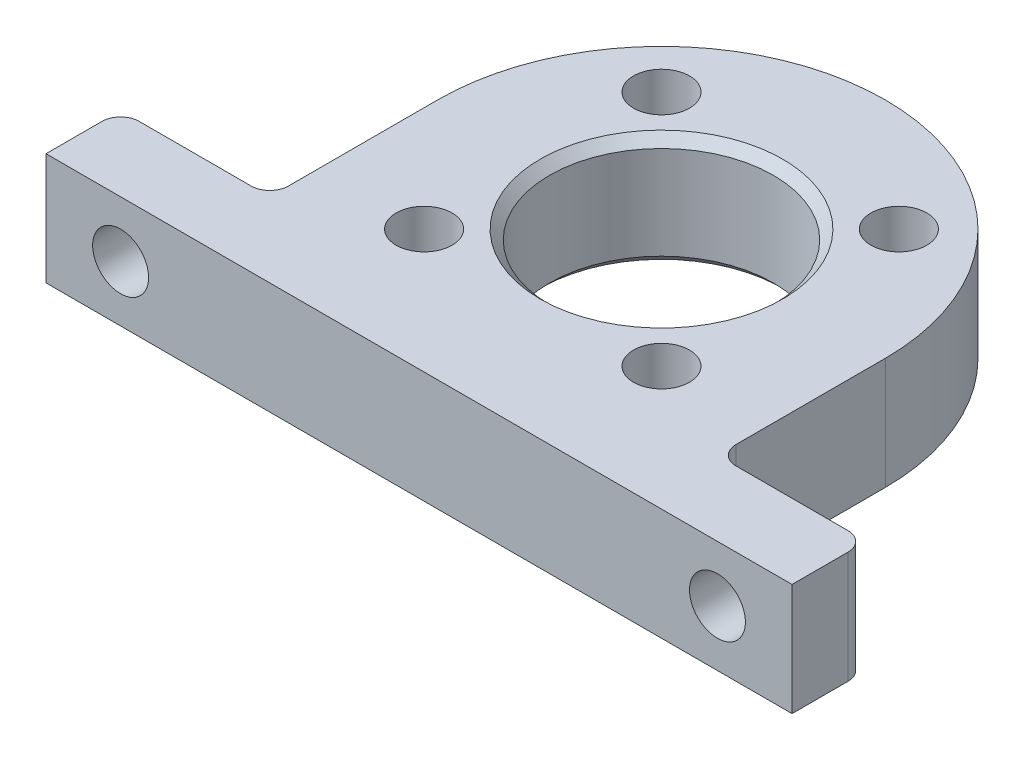
from build123d import *

# Parameters (mm, degrees)
EXTRUDE_1_DEPTH     = 6
SKETCH_2_R          = 6
CUT_EXTRUDE_1_DEPTH = 6
SKETCH_3_R          = 1.5
CUT_EXTRUDE_2_DEPTH = 6
SKETCH_9_W          = 40
SKETCH_9_H          = 6
EXTRUDE_4_DEPTH     = 4
SKETCH_10_R         = 1.5
CUT_EXTRUDE_4_DEPTH = 5
FILLET_2_R          = 1
CHAMFER_1_SIZE      = 0.5


with BuildPart() as part:
    # 草图1 → 凸台-拉伸1 (new body)
    with BuildSketch(Plane(origin=(0, 0, 0), x_dir=(1, 0, 0), z_dir=(0, 1, 0))):
        with BuildLine():
            Line((-12, 0), (-12, -13))
            Line((-12, -13), (12, -13))
            Line((12, -13), (12, 0))
            ThreePointArc((12, 0), (0, 12), (-12, 0))
        make_face()
    extrude(amount=EXTRUDE_1_DEPTH)

    # 草图2 → 切除-拉伸1 (cut)
    with BuildSketch(Plane(origin=(0, 6, 0), x_dir=(1, 0, 0), z_dir=(0, 1, 0))):
        with Locations(Location((0, 0, 0), (0, 0, 270))):
            Circle(SKETCH_2_R)
    extrude(amount=-CUT_EXTRUDE_1_DEPTH, mode=Mode.SUBTRACT)

    # 草图3 → 切除-拉伸2 (cut)
    with BuildSketch(Plane(origin=(0, 6, 0), x_dir=(1, 0, 0), z_dir=(0, 1, 0))):
        with Locations(Location((-6.363961031, 6.363961031, 0), (0, 0, 270))):
            Circle(SKETCH_3_R)
        with Locations(Location((6.363961031, 6.363961031, 0), (0, 0, 270))):
            Circle(SKETCH_3_R)
        with Locations(Location((6.363961031, -6.363961031, 0), (0, 0, 270))):
            Circle(SKETCH_3_R)
        with Locations(Location((-6.363961031, -6.363961031, 0), (0, 0, 270))):
            Circle(SKETCH_3_R)
    extrude(amount=-CUT_EXTRUDE_2_DEPTH, mode=Mode.SUBTRACT)

    # 草图9 → 凸台-拉伸4 (add)
    with BuildSketch(Plane.XY.offset(13)):
        with Locations((0, 3)):
            Rectangle(SKETCH_9_W, SKETCH_9_H)
    extrude(amount=-EXTRUDE_4_DEPTH)

    # 草图10 → 切除-拉伸4 (cut)
    with BuildSketch(Plane.XY.offset(13)):
        with Locations((-16, 3)):
            Circle(SKETCH_10_R)
        with Locations((16, 3)):
            Circle(SKETCH_10_R)
    extrude(amount=-CUT_EXTRUDE_4_DEPTH, mode=Mode.SUBTRACT)

    # 圆角2
    fillet_2_edges = [part.edges().sort_by_distance(p)[0] for p in [
        (-12, 3, 9),
        (12, 3, 9),
        (-20, 3, 9),
        (20, 3, 9),
    ]]
    fillet(fillet_2_edges, radius=FILLET_2_R)

    # 倒角1
    chamfer_1_edges = [part.edges().sort_by_distance(p)[0] for p in [
        (0, 0, -6),
        (0, 6, -6),
    ]]
    chamfer(chamfer_1_edges, length=CHAMFER_1_SIZE)


solid = part.part
